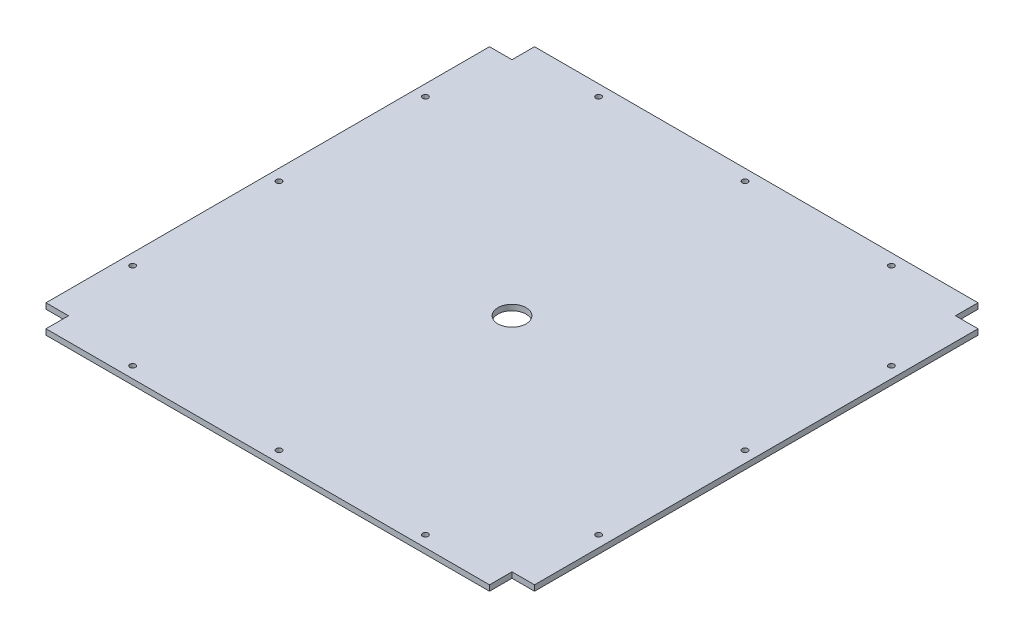
from build123d import *

# Parameters (mm, degrees)
SKETCH1_W           = 434
SKETCH1_H           = 434
BOSS_EXTRUDE1_DEPTH = 5
SKETCH2_R           = 2.5
CUT_EXTRUDE1_DEPTH  = 5
SKETCH3_R           = 12.5
CUT_EXTRUDE2_DEPTH  = 5
SKETCH4_W           = 20
SKETCH4_H           = 20
CUT_EXTRUDE3_DEPTH  = 10


with BuildPart() as part:
    # Sketch1 → Boss-Extrude1 (new body)
    with BuildSketch(Plane(origin=(0, 0, 0), x_dir=(1, 0, 0), z_dir=(0, 1, 0))):
        Rectangle(SKETCH1_W, SKETCH1_H)
    extrude(amount=BOSS_EXTRUDE1_DEPTH)

    # Sketch2 → Cut-Extrude1 (cut)
    with BuildSketch(Plane(origin=(0, 5, 0), x_dir=(1, 0, 0), z_dir=(0, 1, 0))):
        with Locations(Location((-207, 130, 0), (0, 0, 270))):
            Circle(SKETCH2_R)
        with Locations(Location((-207, 0, 0), (0, 0, 270))):
            Circle(SKETCH2_R)
        with Locations(Location((-207, -130, 0), (0, 0, 90))):
            Circle(SKETCH2_R)
        with Locations(Location((207, -130, 0), (0, 0, 270))):
            Circle(SKETCH2_R)
        with Locations(Location((207, 0, 0), (0, 0, 90))):
            Circle(SKETCH2_R)
        with Locations(Location((207, 130, 0), (0, 0, 90))):
            Circle(SKETCH2_R)
        with Locations(Location((130, 207, 0), (0, 0, 270))):
            Circle(SKETCH2_R)
        with Locations(Location((0, 207, 0), (0, 0, 270))):
            Circle(SKETCH2_R)
        with Locations(Location((-130, 207, 0), (0, 0, 90))):
            Circle(SKETCH2_R)
        with Locations(Location((-130, -207, 0), (0, 0, 270))):
            Circle(SKETCH2_R)
        with Locations(Location((0, -207, 0), (0, 0, 90))):
            Circle(SKETCH2_R)
        with Locations(Location((130, -207, 0), (0, 0, 90))):
            Circle(SKETCH2_R)
    extrude(amount=-CUT_EXTRUDE1_DEPTH, mode=Mode.SUBTRACT)

    # Sketch3 → Cut-Extrude2 (cut)
    with BuildSketch(Plane(origin=(0, 5, 0), x_dir=(1, 0, 0), z_dir=(0, 1, 0))):
        with Locations(Location((0, 0, 0), (0, 0, 270))):
            Circle(SKETCH3_R)
    extrude(amount=-CUT_EXTRUDE2_DEPTH, mode=Mode.SUBTRACT)

    # Sketch4 → Cut-Extrude3 (cut)
    with BuildSketch(Plane(origin=(0, 5, 0), x_dir=(1, 0, 0), z_dir=(0, 1, 0))):
        with Locations((-207, 207)):
            Rectangle(SKETCH4_W, SKETCH4_H)
        with Locations((207, 207)):
            Rectangle(SKETCH4_W, SKETCH4_H)
        with Locations((207, -207)):
            Rectangle(SKETCH4_W, SKETCH4_H)
        with Locations((-207, -207)):
            Rectangle(SKETCH4_W, SKETCH4_H)
    extrude(amount=-CUT_EXTRUDE3_DEPTH, mode=Mode.SUBTRACT)


solid = part.part
